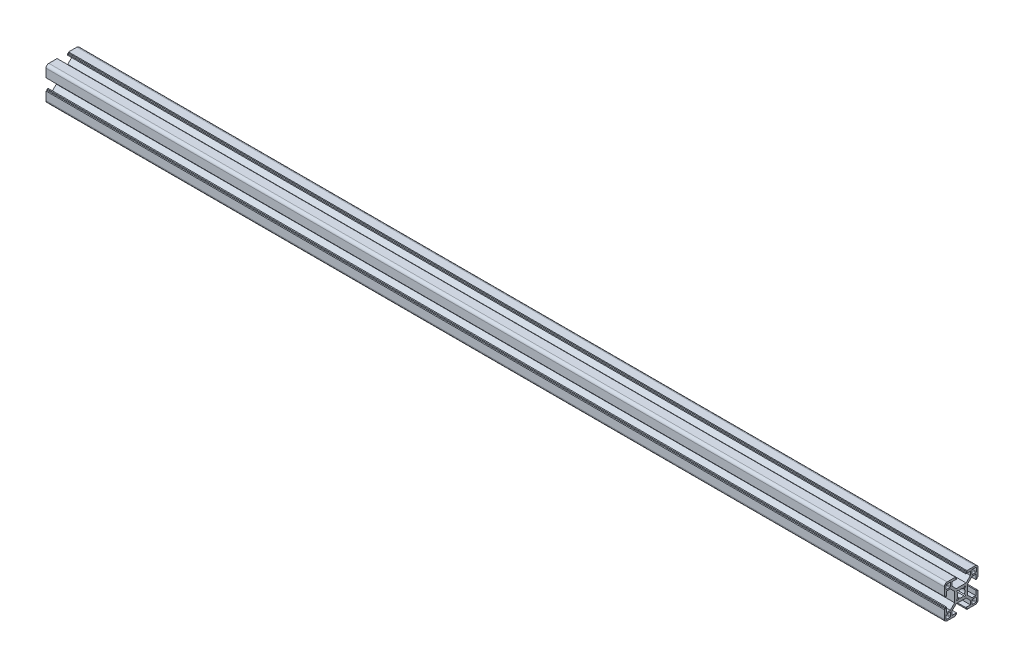
from build123d import *

# Parameters (mm, degrees)
EXTRUDE_1_DEPTH = 50
EXTRUDE_2_DEPTH = 800


with BuildPart() as part:
    # 草图1 → 凸台-拉伸1 (new body)
    with BuildSketch(Plane(origin=(0, 0, 0), x_dir=(0, 0, -1), z_dir=(1, 0, 0))):
        with BuildLine():
            Line((-5.14957074, -13.70467014), (-4.14957074, -13.70467014))
            Line((-4.14957074, -13.70467014), (-4.14957074, -12.70467014))
            Line((-4.14957074, -12.70467014), (-8.29957074, -12.70467014))
            Line((-8.29957074, -12.70467014), (-8.29957074, -9.3688837))
            Line((-8.29957074, -9.3688837), (-4.43535718, -5.50467014))
            Line((-4.43535718, -5.50467014), (4.3362157, -5.50467014))
            Line((4.3362157, -5.50467014), (8.20042926, -9.3688837))
            Line((8.20042926, -9.3688837), (8.20042926, -12.70467014))
            Line((8.20042926, -12.70467014), (4.05042926, -12.70467014))
            Line((4.05042926, -12.70467014), (4.05042926, -13.70467014))
            Line((4.05042926, -13.70467014), (5.05042926, -13.70467014))
            Line((5.05042926, -13.70467014), (5.05042926, -14.70467014))
            Line((5.05042926, -14.70467014), (12.45042926, -14.70467014))
            ThreePointArc((12.45042926, -14.70467014), (14.218196213, -13.972437093), (14.95042926, -12.20467014))
            Line((14.95042926, -12.20467014), (14.95042926, -4.80467014))
            Line((14.95042926, -4.80467014), (13.95042926, -4.80467014))
            Line((13.95042926, -4.80467014), (13.95042926, -3.80467014))
            Line((13.95042926, -3.80467014), (12.95042926, -3.80467014))
            Line((12.95042926, -3.80467014), (12.95042926, -7.95467014))
            Line((12.95042926, -7.95467014), (9.61464282, -7.95467014))
            Line((9.61464282, -7.95467014), (5.75042926, -4.09045658))
            Line((5.75042926, -4.09045658), (5.75042926, 4.6811163))
            Line((5.75042926, 4.6811163), (9.61464282, 8.54532986))
            Line((9.61464282, 8.54532986), (12.95042926, 8.54532986))
            Line((12.95042926, 8.54532986), (12.95042926, 4.39532986))
            Line((12.95042926, 4.39532986), (13.95042926, 4.39532986))
            Line((13.95042926, 4.39532986), (13.95042926, 5.39532986))
            Line((13.95042926, 5.39532986), (14.95042926, 5.39532986))
            Line((14.95042926, 5.39532986), (14.95042926, 12.79532986))
            ThreePointArc((14.95042926, 12.79532986), (14.218196213, 14.563096813), (12.45042926, 15.29532986))
            Line((12.45042926, 15.29532986), (5.05042926, 15.29532986))
            Line((5.05042926, 15.29532986), (5.05042926, 14.29532986))
            Line((5.05042926, 14.29532986), (4.05042926, 14.29532986))
            Line((4.05042926, 14.29532986), (4.05042926, 13.29532986))
            Line((4.05042926, 13.29532986), (8.20042926, 13.29532986))
            Line((8.20042926, 13.29532986), (8.20042926, 9.95954342))
            Line((8.20042926, 9.95954342), (4.3362157, 6.09532986))
            Line((4.3362157, 6.09532986), (-4.43535718, 6.09532986))
            Line((-4.43535718, 6.09532986), (-8.29957074, 9.95954342))
            Line((-8.29957074, 9.95954342), (-8.29957074, 13.29532986))
            Line((-8.29957074, 13.29532986), (-4.14957074, 13.29532986))
            Line((-4.14957074, 13.29532986), (-4.14957074, 14.29532986))
            Line((-4.14957074, 14.29532986), (-5.14957074, 14.29532986))
            Line((-5.14957074, 14.29532986), (-5.14957074, 15.29532986))
            Line((-5.14957074, 15.29532986), (-12.54957074, 15.29532986))
            ThreePointArc((-12.54957074, 15.29532986), (-14.317337693, 14.563096813), (-15.04957074, 12.79532986))
            Line((-15.04957074, 12.79532986), (-15.04957074, 5.39532986))
            Line((-15.04957074, 5.39532986), (-14.04957074, 5.39532986))
            Line((-14.04957074, 5.39532986), (-14.04957074, 4.39532986))
            Line((-14.04957074, 4.39532986), (-13.04957074, 4.39532986))
            Line((-13.04957074, 4.39532986), (-13.04957074, 8.54532986))
            Line((-13.04957074, 8.54532986), (-9.7137843, 8.54532986))
            Line((-9.7137843, 8.54532986), (-5.84957074, 4.6811163))
            Line((-5.84957074, 4.6811163), (-5.84957074, -4.09045658))
            Line((-5.84957074, -4.09045658), (-9.7137843, -7.95467014))
            Line((-9.7137843, -7.95467014), (-13.04957074, -7.95467014))
            Line((-13.04957074, -7.95467014), (-13.04957074, -3.80467014))
            Line((-13.04957074, -3.80467014), (-14.04957074, -3.80467014))
            Line((-14.04957074, -3.80467014), (-14.04957074, -4.80467014))
            Line((-14.04957074, -4.80467014), (-15.04957074, -4.80467014))
            Line((-15.04957074, -4.80467014), (-15.04957074, -12.20467014))
            ThreePointArc((-15.04957074, -12.20467014), (-14.317337693, -13.972437093), (-12.54957074, -14.70467014))
            Line((-12.54957074, -14.70467014), (-5.14957074, -14.70467014))
            Line((-5.14957074, -14.70467014), (-5.14957074, -13.70467014))
        make_face()
        with BuildLine():
            Line((-10.04957074, 9.79532986), (-13.04957074, 9.79532986))
            ThreePointArc((-13.04957074, 9.79532986), (-13.403124131, 9.941776469), (-13.54957074, 10.29532986))
            Line((-13.54957074, 10.29532986), (-13.54957074, 13.29532986))
            ThreePointArc((-13.54957074, 13.29532986), (-13.403124131, 13.648883251), (-13.04957074, 13.79532986))
            Line((-13.04957074, 13.79532986), (-10.04957074, 13.79532986))
            ThreePointArc((-10.04957074, 13.79532986), (-9.696017349, 13.648883251), (-9.54957074, 13.29532986))
            Line((-9.54957074, 13.29532986), (-9.54957074, 10.29532986))
            ThreePointArc((-9.54957074, 10.29532986), (-9.696017349, 9.941776469), (-10.04957074, 9.79532986))
        make_face(mode=Mode.SUBTRACT)
        with BuildLine():
            Line((-10.04957074, -13.20467014), (-13.04957074, -13.20467014))
            ThreePointArc((-13.04957074, -13.20467014), (-13.403124131, -13.058223531), (-13.54957074, -12.70467014))
            Line((-13.54957074, -12.70467014), (-13.54957074, -9.70467014))
            ThreePointArc((-13.54957074, -9.70467014), (-13.403124131, -9.351116749), (-13.04957074, -9.20467014))
            Line((-13.04957074, -9.20467014), (-10.04957074, -9.20467014))
            ThreePointArc((-10.04957074, -9.20467014), (-9.696017349, -9.351116749), (-9.54957074, -9.70467014))
            Line((-9.54957074, -9.70467014), (-9.54957074, -12.70467014))
            ThreePointArc((-9.54957074, -12.70467014), (-9.696017349, -13.058223531), (-10.04957074, -13.20467014))
        make_face(mode=Mode.SUBTRACT)
        with BuildLine():
            Line((12.95042926, 9.79532986), (9.95042926, 9.79532986))
            ThreePointArc((9.95042926, 9.79532986), (9.596875869, 9.941776469), (9.45042926, 10.29532986))
            Line((9.45042926, 10.29532986), (9.45042926, 13.29532986))
            ThreePointArc((9.45042926, 13.29532986), (9.596875869, 13.648883251), (9.95042926, 13.79532986))
            Line((9.95042926, 13.79532986), (12.95042926, 13.79532986))
            ThreePointArc((12.95042926, 13.79532986), (13.303982651, 13.648883251), (13.45042926, 13.29532986))
            Line((13.45042926, 13.29532986), (13.45042926, 10.29532986))
            ThreePointArc((13.45042926, 10.29532986), (13.303982651, 9.941776469), (12.95042926, 9.79532986))
        make_face(mode=Mode.SUBTRACT)
        with BuildLine():
            Line((13.45042926, -9.70467014), (13.45042926, -12.70467014))
            ThreePointArc((13.45042926, -12.70467014), (13.303982651, -13.058223531), (12.95042926, -13.20467014))
            Line((12.95042926, -13.20467014), (9.95042926, -13.20467014))
            ThreePointArc((9.95042926, -13.20467014), (9.596875869, -13.058223531), (9.45042926, -12.70467014))
            Line((9.45042926, -12.70467014), (9.45042926, -9.70467014))
            ThreePointArc((9.45042926, -9.70467014), (9.596875869, -9.351116749), (9.95042926, -9.20467014))
            Line((9.95042926, -9.20467014), (12.95042926, -9.20467014))
            ThreePointArc((12.95042926, -9.20467014), (13.303982651, -9.351116749), (13.45042926, -9.70467014))
        make_face(mode=Mode.SUBTRACT)
        with BuildLine():
            Line((-4.07998961, 3.61864195), (-3.37288283, 4.32574873))
            Line((-3.37288283, 4.32574873), (-2.07404174, 3.02690764))
            ThreePointArc((-2.07404174, 3.02690764), (-0.04957074, 3.69532986), (1.97490026, 3.02690764))
            Line((1.97490026, 3.02690764), (3.27374135, 4.32574873))
            Line((3.27374135, 4.32574873), (3.98084813, 3.61864195))
            Line((3.98084813, 3.61864195), (2.68200704, 2.31980086))
            ThreePointArc((2.68200704, 2.31980086), (3.35042926, 0.29532986), (2.68200704, -1.72914114))
            Line((2.68200704, -1.72914114), (3.98084813, -3.02798223))
            Line((3.98084813, -3.02798223), (3.27374135, -3.73508901))
            Line((3.27374135, -3.73508901), (1.97490026, -2.43624792))
            ThreePointArc((1.97490026, -2.43624792), (-0.04957074, -3.10467014), (-2.07404174, -2.43624792))
            Line((-2.07404174, -2.43624792), (-3.37288283, -3.73508901))
            Line((-3.37288283, -3.73508901), (-4.07998961, -3.02798223))
            Line((-4.07998961, -3.02798223), (-2.78114852, -1.72914114))
            ThreePointArc((-2.78114852, -1.72914114), (-3.44957074, 0.29532986), (-2.78114852, 2.31980086))
            Line((-2.78114852, 2.31980086), (-4.07998961, 3.61864195))
        make_face(mode=Mode.SUBTRACT)
    extrude(amount=-EXTRUDE_1_DEPTH)

    # 草图2 → 凸台-拉伸2 (add)
    with BuildSketch(Plane(origin=(0, 0, 0), x_dir=(0, 0, -1), z_dir=(1, 0, 0))):
        with BuildLine():
            Line((-15.04957074, -4.80467014), (-15.04957074, -12.20467014))
            ThreePointArc((-15.04957074, -12.20467014), (-14.317337693, -13.972437093), (-12.54957074, -14.70467014))
            Line((-12.54957074, -14.70467014), (-5.14957074, -14.70467014))
            Line((-5.14957074, -14.70467014), (-5.14957074, -13.70467014))
            Line((-5.14957074, -13.70467014), (-4.14957074, -13.70467014))
            Line((-4.14957074, -13.70467014), (-4.14957074, -12.70467014))
            Line((-4.14957074, -12.70467014), (-8.29957074, -12.70467014))
            Line((-8.29957074, -12.70467014), (-8.29957074, -9.3688837))
            Line((-8.29957074, -9.3688837), (-4.43535718, -5.50467014))
            Line((-4.43535718, -5.50467014), (4.3362157, -5.50467014))
            Line((4.3362157, -5.50467014), (8.20042926, -9.3688837))
            Line((8.20042926, -9.3688837), (8.20042926, -12.70467014))
            Line((8.20042926, -12.70467014), (4.05042926, -12.70467014))
            Line((4.05042926, -12.70467014), (4.05042926, -13.70467014))
            Line((4.05042926, -13.70467014), (5.05042926, -13.70467014))
            Line((5.05042926, -13.70467014), (5.05042926, -14.70467014))
            Line((5.05042926, -14.70467014), (12.45042926, -14.70467014))
            ThreePointArc((12.45042926, -14.70467014), (14.218196213, -13.972437093), (14.95042926, -12.20467014))
            Line((14.95042926, -12.20467014), (14.95042926, -4.80467014))
            Line((14.95042926, -4.80467014), (13.95042926, -4.80467014))
            Line((13.95042926, -4.80467014), (13.95042926, -3.80467014))
            Line((13.95042926, -3.80467014), (12.95042926, -3.80467014))
            Line((12.95042926, -3.80467014), (12.95042926, -7.95467014))
            Line((12.95042926, -7.95467014), (9.61464282, -7.95467014))
            Line((9.61464282, -7.95467014), (5.75042926, -4.09045658))
            Line((5.75042926, -4.09045658), (5.75042926, 4.6811163))
            Line((5.75042926, 4.6811163), (9.61464282, 8.54532986))
            Line((9.61464282, 8.54532986), (12.95042926, 8.54532986))
            Line((12.95042926, 8.54532986), (12.95042926, 4.39532986))
            Line((12.95042926, 4.39532986), (13.95042926, 4.39532986))
            Line((13.95042926, 4.39532986), (13.95042926, 5.39532986))
            Line((13.95042926, 5.39532986), (14.95042926, 5.39532986))
            Line((14.95042926, 5.39532986), (14.95042926, 12.79532986))
            ThreePointArc((14.95042926, 12.79532986), (14.218196213, 14.563096813), (12.45042926, 15.29532986))
            Line((12.45042926, 15.29532986), (5.05042926, 15.29532986))
            Line((5.05042926, 15.29532986), (5.05042926, 14.29532986))
            Line((5.05042926, 14.29532986), (4.05042926, 14.29532986))
            Line((4.05042926, 14.29532986), (4.05042926, 13.29532986))
            Line((4.05042926, 13.29532986), (8.20042926, 13.29532986))
            Line((8.20042926, 13.29532986), (8.20042926, 9.95954342))
            Line((8.20042926, 9.95954342), (4.3362157, 6.09532986))
            Line((4.3362157, 6.09532986), (-4.43535718, 6.09532986))
            Line((-4.43535718, 6.09532986), (-8.29957074, 9.95954342))
            Line((-8.29957074, 9.95954342), (-8.29957074, 13.29532986))
            Line((-8.29957074, 13.29532986), (-4.14957074, 13.29532986))
            Line((-4.14957074, 13.29532986), (-4.14957074, 14.29532986))
            Line((-4.14957074, 14.29532986), (-5.14957074, 14.29532986))
            Line((-5.14957074, 14.29532986), (-5.14957074, 15.29532986))
            Line((-5.14957074, 15.29532986), (-12.54957074, 15.29532986))
            ThreePointArc((-12.54957074, 15.29532986), (-14.317337693, 14.563096813), (-15.04957074, 12.79532986))
            Line((-15.04957074, 12.79532986), (-15.04957074, 5.39532986))
            Line((-15.04957074, 5.39532986), (-14.04957074, 5.39532986))
            Line((-14.04957074, 5.39532986), (-14.04957074, 4.39532986))
            Line((-14.04957074, 4.39532986), (-13.04957074, 4.39532986))
            Line((-13.04957074, 4.39532986), (-13.04957074, 8.54532986))
            Line((-13.04957074, 8.54532986), (-9.7137843, 8.54532986))
            Line((-9.7137843, 8.54532986), (-5.84957074, 4.6811163))
            Line((-5.84957074, 4.6811163), (-5.84957074, -4.09045658))
            Line((-5.84957074, -4.09045658), (-9.7137843, -7.95467014))
            Line((-9.7137843, -7.95467014), (-13.04957074, -7.95467014))
            Line((-13.04957074, -7.95467014), (-13.04957074, -3.80467014))
            Line((-13.04957074, -3.80467014), (-14.04957074, -3.80467014))
            Line((-14.04957074, -3.80467014), (-14.04957074, -4.80467014))
            Line((-14.04957074, -4.80467014), (-15.04957074, -4.80467014))
        make_face()
        with BuildLine():
            Line((-13.04957074, 9.79532986), (-10.04957074, 9.79532986))
            ThreePointArc((-10.04957074, 9.79532986), (-9.696017349, 9.941776469), (-9.54957074, 10.29532986))
            Line((-9.54957074, 10.29532986), (-9.54957074, 13.29532986))
            ThreePointArc((-9.54957074, 13.29532986), (-9.696017349, 13.648883251), (-10.04957074, 13.79532986))
            Line((-10.04957074, 13.79532986), (-13.04957074, 13.79532986))
            ThreePointArc((-13.04957074, 13.79532986), (-13.403124131, 13.648883251), (-13.54957074, 13.29532986))
            Line((-13.54957074, 13.29532986), (-13.54957074, 10.29532986))
            ThreePointArc((-13.54957074, 10.29532986), (-13.403124131, 9.941776469), (-13.04957074, 9.79532986))
        make_face(mode=Mode.SUBTRACT)
        with BuildLine():
            Line((-13.04957074, -13.20467014), (-10.04957074, -13.20467014))
            ThreePointArc((-10.04957074, -13.20467014), (-9.696017349, -13.058223531), (-9.54957074, -12.70467014))
            Line((-9.54957074, -12.70467014), (-9.54957074, -9.70467014))
            ThreePointArc((-9.54957074, -9.70467014), (-9.696017349, -9.351116749), (-10.04957074, -9.20467014))
            Line((-10.04957074, -9.20467014), (-13.04957074, -9.20467014))
            ThreePointArc((-13.04957074, -9.20467014), (-13.403124131, -9.351116749), (-13.54957074, -9.70467014))
            Line((-13.54957074, -9.70467014), (-13.54957074, -12.70467014))
            ThreePointArc((-13.54957074, -12.70467014), (-13.403124131, -13.058223531), (-13.04957074, -13.20467014))
        make_face(mode=Mode.SUBTRACT)
        with BuildLine():
            Line((9.45042926, 13.29532986), (9.45042926, 10.29532986))
            ThreePointArc((9.45042926, 10.29532986), (9.596875869, 9.941776469), (9.95042926, 9.79532986))
            Line((9.95042926, 9.79532986), (12.95042926, 9.79532986))
            ThreePointArc((12.95042926, 9.79532986), (13.303982651, 9.941776469), (13.45042926, 10.29532986))
            Line((13.45042926, 10.29532986), (13.45042926, 13.29532986))
            ThreePointArc((13.45042926, 13.29532986), (13.303982651, 13.648883251), (12.95042926, 13.79532986))
            Line((12.95042926, 13.79532986), (9.95042926, 13.79532986))
            ThreePointArc((9.95042926, 13.79532986), (9.596875869, 13.648883251), (9.45042926, 13.29532986))
        make_face(mode=Mode.SUBTRACT)
        with BuildLine():
            Line((9.45042926, -9.70467014), (9.45042926, -12.70467014))
            ThreePointArc((9.45042926, -12.70467014), (9.596875869, -13.058223531), (9.95042926, -13.20467014))
            Line((9.95042926, -13.20467014), (12.95042926, -13.20467014))
            ThreePointArc((12.95042926, -13.20467014), (13.303982651, -13.058223531), (13.45042926, -12.70467014))
            Line((13.45042926, -12.70467014), (13.45042926, -9.70467014))
            ThreePointArc((13.45042926, -9.70467014), (13.303982651, -9.351116749), (12.95042926, -9.20467014))
            Line((12.95042926, -9.20467014), (9.95042926, -9.20467014))
            ThreePointArc((9.95042926, -9.20467014), (9.596875869, -9.351116749), (9.45042926, -9.70467014))
        make_face(mode=Mode.SUBTRACT)
        with BuildLine():
            Line((-3.37288283, -3.73508901), (-2.07404174, -2.43624792))
            ThreePointArc((-2.07404174, -2.43624792), (-0.04957074, -3.10467014), (1.97490026, -2.43624792))
            Line((1.97490026, -2.43624792), (3.27374135, -3.73508901))
            Line((3.27374135, -3.73508901), (3.98084813, -3.02798223))
            Line((3.98084813, -3.02798223), (2.68200704, -1.72914114))
            ThreePointArc((2.68200704, -1.72914114), (3.35042926, 0.29532986), (2.68200704, 2.31980086))
            Line((2.68200704, 2.31980086), (3.98084813, 3.61864195))
            Line((3.98084813, 3.61864195), (3.27374135, 4.32574873))
            Line((3.27374135, 4.32574873), (1.97490026, 3.02690764))
            ThreePointArc((1.97490026, 3.02690764), (-0.04957074, 3.69532986), (-2.07404174, 3.02690764))
            Line((-2.07404174, 3.02690764), (-3.37288283, 4.32574873))
            Line((-3.37288283, 4.32574873), (-4.07998961, 3.61864195))
            Line((-4.07998961, 3.61864195), (-2.78114852, 2.31980086))
            ThreePointArc((-2.78114852, 2.31980086), (-3.44957074, 0.29532986), (-2.78114852, -1.72914114))
            Line((-2.78114852, -1.72914114), (-4.07998961, -3.02798223))
            Line((-4.07998961, -3.02798223), (-3.37288283, -3.73508901))
        make_face(mode=Mode.SUBTRACT)
    extrude(amount=-EXTRUDE_2_DEPTH)


solid = part.part
